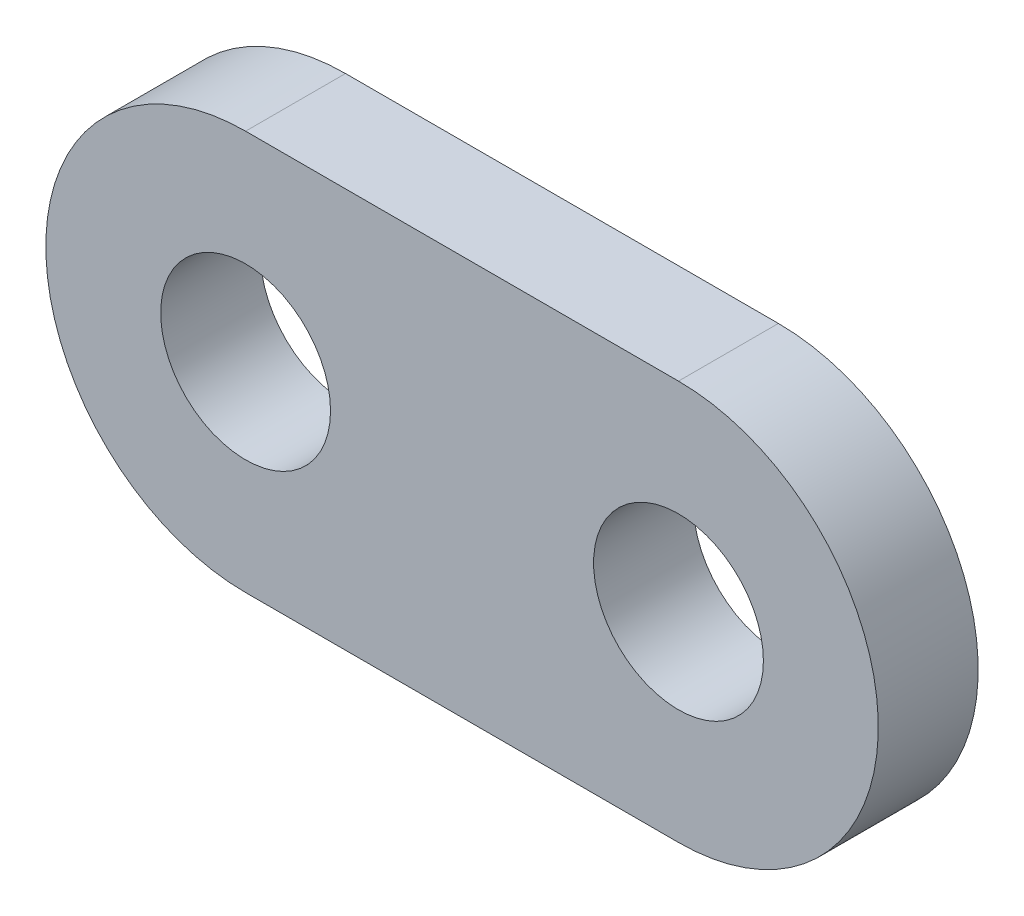
from build123d import *

# Parameters (mm, degrees)
MODEL_R                         = 2.55
AUFSATZ_LINEAR_AUSTRAGEN1_DEPTH = 3


with BuildPart() as part:
    # Model → Aufsatz-Linear austragen1 (new body)
    with BuildSketch(Plane.XY):
        with BuildLine():
            Line((19, 12), (6, 12))
            ThreePointArc((6, 12), (0, 6), (6, 0))
            Line((6, 0), (19, 0))
            ThreePointArc((19, 0), (25, 6), (19, 12))
        make_face()
        with Locations((6, 6)):
            Circle(MODEL_R, mode=Mode.SUBTRACT)
        with Locations((19, 6)):
            Circle(MODEL_R, mode=Mode.SUBTRACT)
    extrude(amount=AUFSATZ_LINEAR_AUSTRAGEN1_DEPTH)


solid = part.part
